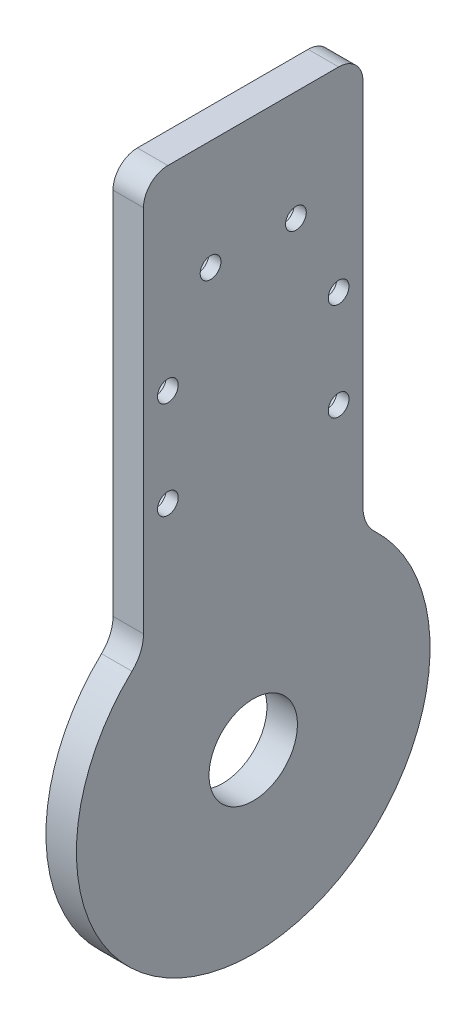
from build123d import *

# Parameters (mm, degrees)
PLATE_START        = -33.55
SKETCH1_R          = 7.25
PLATE_I_DEPTH      = 5
BOLT_START         = -33.75
SKETCH2_R          = 1.7
BOLT_HOLES_DEPTH   = 5.4
COUNTERBORES_START = -33.75
SKETCH3_R          = 3.2
COUNTERBORES_DEPTH = 3.2


with BuildPart() as part:
    # Sketch1 → Plate I (new body)
    with BuildSketch(Plane(origin=(0, 0, 0), x_dir=(0, 0, -1), z_dir=(1, 0, 0)).offset(PLATE_START)):
        with BuildLine():
            Line((-32, 227.975478406), (-32, 288.5))
            ThreePointArc((-32, 288.5), (-30.828427125, 291.328427125), (-28, 292.5))
            Line((-28, 292.5), (0, 292.5))
            ThreePointArc((0, 292.5), (2.828427125, 291.328427125), (4, 288.5))
            Line((4, 288.5), (4, 227.975478406))
            ThreePointArc((4, 227.975478406), (4.49156491, 225.597003504), (5.885714286, 223.608253536))
            ThreePointArc((5.885714286, 223.608253536), (-14, 173.5), (-33.885714286, 223.608253536))
            ThreePointArc((-33.885714286, 223.608253536), (-32.49156491, 225.597003504), (-32, 227.975478406))
        make_face()
        with Locations((-14, 202.5)):
            Circle(SKETCH1_R, mode=Mode.SUBTRACT)
    extrude(amount=PLATE_I_DEPTH)

    # Sketch2 → Bolt holes (cut)
    with BuildSketch(Plane(origin=(0, 0, 0), x_dir=(0, 0, -1), z_dir=(1, 0, 0)).offset(BOLT_START)):
        with Locations((0, 244.5)):
            Circle(SKETCH2_R)
        with Locations((-28, 244.5)):
            Circle(SKETCH2_R)
        with Locations((0, 260.5)):
            Circle(SKETCH2_R)
        with Locations((-28, 260.5)):
            Circle(SKETCH2_R)
        with Locations((-7, 274.5)):
            Circle(SKETCH2_R)
        with Locations((-21, 274.5)):
            Circle(SKETCH2_R)
    extrude(amount=BOLT_HOLES_DEPTH, mode=Mode.SUBTRACT)

    # Sketch3 → Counterbores (cut)
    with BuildSketch(Plane(origin=(0, 0, 0), x_dir=(0, 0, -1), z_dir=(1, 0, 0)).offset(COUNTERBORES_START)):
        with Locations((0, 244.5)):
            Circle(SKETCH3_R)
        with Locations((-28, 244.5)):
            Circle(SKETCH3_R)
        with Locations((0, 260.5)):
            Circle(SKETCH3_R)
        with Locations((-28, 260.5)):
            Circle(SKETCH3_R)
        with Locations((-7, 274.5)):
            Circle(SKETCH3_R)
        with Locations((-21, 274.5)):
            Circle(SKETCH3_R)
    extrude(amount=COUNTERBORES_DEPTH, mode=Mode.SUBTRACT)


solid = part.part
